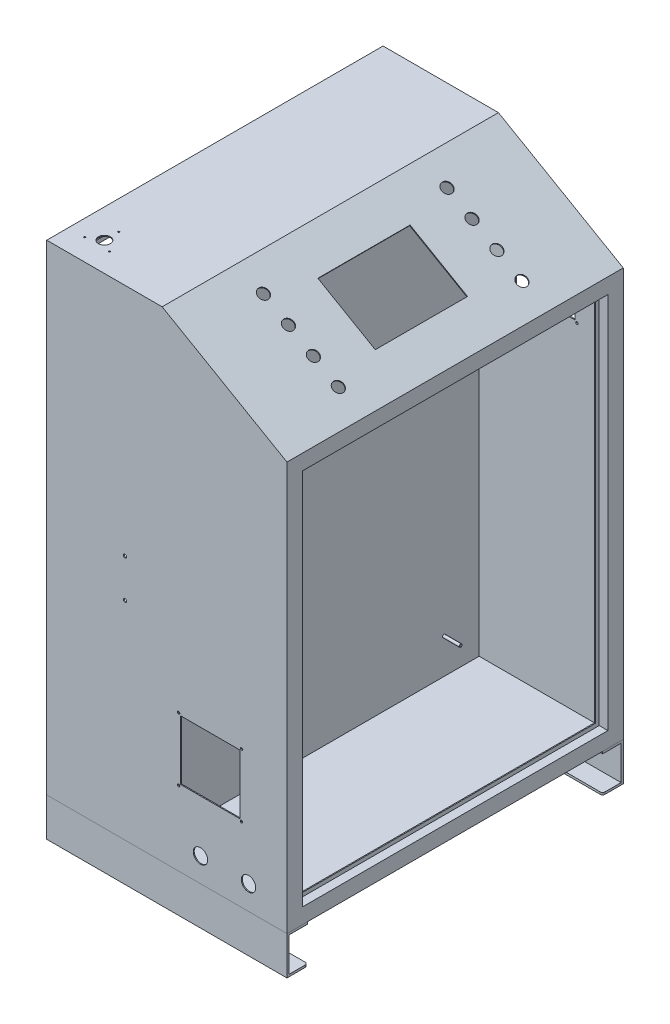
from build123d import *

# Parameters (mm, degrees)
EXTRUDE_1_DEPTH             = 348
EXTRUDE_2_DEPTH             = 2
EXTRUDE_3_DEPTH             = 2
SKETCH_4_W                  = 640
SKETCH_4_H                  = 790
CUT_EXTRUDE_1_DEPTH         = 10
SKETCH_7_W                  = 640
SKETCH_7_H                  = 790
SKETCH_7_W_2                = 636
SKETCH_7_H_2                = 786
EXTRUDE_4_DEPTH             = 18
SKETCH_8_W                  = 696
SKETCH_8_H                  = 996
CUT_EXTRUDE_2_DEPTH         = 10
SKETCH_9_W                  = 640
SKETCH_9_H                  = 790
SKETCH_9_W_2                = 620
SKETCH_9_H_2                = 770
EXTRUDE_5_DEPTH             = 2
EXTRUDE_START               = -200
SKETCH_10_W                 = 696
SKETCH_10_H                 = 996
EXTRUDE_6_DEPTH             = 2
SKETCH_11_W                 = 138
SKETCH_11_H                 = 192
CUT_EXTRUDE_3_DEPTH         = 10
EXTRUDE_7_DEPTH             = 500
EXTRUDE_7_2_DEPTH           = 500
SKETCH_13_R                 = 11.25
CUT_EXTRUDE_4_DEPTH         = 10
SKETCH_23_R                 = 15
CUT_EXTRUDE_8_DEPTH         = 10
SKETCH_29_R                 = 2.5
SKETCH_29_W                 = 124
SKETCH_29_H                 = 124
CUT_EXTRUDE_13_DEPTH        = 10
SKETCH_31_R                 = 12.5
CUT_EXTRUDE_16_DEPTH        = 10
SKETCH_34_W                 = 696
SKETCH_34_H                 = 996
SKETCH_34_W_2               = 640
SKETCH_34_H_2               = 940
EXTRUDE_10_DEPTH            = 2
SKETCH_36_W                 = 640
SKETCH_36_H                 = 940
SKETCH_36_W_2               = 636
SKETCH_36_H_2               = 936
EXTRUDE_11_DEPTH            = 18
SKETCH_37_W                 = 636
SKETCH_37_H                 = 936
SKETCH_37_W_2               = 620
SKETCH_37_H_2               = 920
EXTRUDE_12_DEPTH            = 2
FILLET_1_R                  = 5
FILLET_2_R                  = 5
SKETCH_41_R                 = 2.5
SKETCH_41_W                 = 124
SKETCH_41_H                 = 124
CUT_EXTRUDE_21_DEPTH        = 10
SKETCH_42_R                 = 3
EXTRUDE_13_DEPTH            = 35
CHAMFER_1_SIZE              = 0.5
HOLE_WIZARD_M4_1_AT_2_COUNT = 2
HOLE_WIZARD_M4_1_AT_2_PITCH = 51.961524227
HOLE_WIZARD_M4_1_AT_3_COUNT = 2
HOLE_WIZARD_M4_1_AT_3_PITCH = 51.961524227
HOLE_WIZARD_M8_1_AT_2_COUNT = 2
HOLE_WIZARD_M8_1_AT_2_PITCH = 80


with BuildPart() as part:
    # 草图1 → 凸台-拉伸1 (new, symmetric)
    with BuildSketch(Plane.XY):
        Polygon((0, 0), (0, 1000), (240.192378865, 1000), (500, 850), (500, 0), align=None)
        Polygon((2, 2), (2, 998), (239.65648048, 998), (498, 848.845299462), (498, 2), align=None, mode=Mode.SUBTRACT)
    extrude(amount=EXTRUDE_1_DEPTH, both=True)

    # 草图2 → 凸台-拉伸2 (add)
    with BuildSketch(Plane.XY.offset(348)):
        Polygon((0, 0), (500, 0), (500, 850), (240.192378865, 1000), (0, 1000), align=None)
    extrude(amount=EXTRUDE_2_DEPTH)

    # 草图3 → 凸台-拉伸3 (add)
    with BuildSketch(Plane(origin=(0, 0, -348), x_dir=(-1, 0, 0), z_dir=(0, 0, -1))):
        Polygon((-500, 0), (0, 0), (0, 1000), (-240.192378865, 1000), (-500, 850), align=None)
    extrude(amount=EXTRUDE_3_DEPTH)

    # 草图4 → 切除-拉伸1 (cut)
    with BuildSketch(Plane(origin=(500, 0, 0), x_dir=(0, 0, -1), z_dir=(1, 0, 0))):
        with Locations((0, 425)):
            Rectangle(SKETCH_4_W, SKETCH_4_H)
    extrude(amount=-CUT_EXTRUDE_1_DEPTH, mode=Mode.SUBTRACT)

    # 草图7 → 凸台-拉伸4 (add)
    with BuildSketch(Plane(origin=(500, 0, 0), x_dir=(0, 0, -1), z_dir=(1, 0, 0))):
        with Locations((0, 425)):
            Rectangle(SKETCH_7_W, SKETCH_7_H)
        with Locations((0, 425)):
            Rectangle(SKETCH_7_W_2, SKETCH_7_H_2, mode=Mode.SUBTRACT)
    extrude(amount=-EXTRUDE_4_DEPTH)

    # 草图8 → 切除-拉伸2 (cut)
    with BuildSketch(Plane.ZY):
        with Locations((0, 500)):
            Rectangle(SKETCH_8_W, SKETCH_8_H)
    extrude(amount=-CUT_EXTRUDE_2_DEPTH, mode=Mode.SUBTRACT)

    # 草图9 → 凸台-拉伸5 (add)
    with BuildSketch(Plane.ZY.offset(-482)):
        with Locations((0, 425)):
            Rectangle(SKETCH_9_W, SKETCH_9_H)
        with Locations((0, 425)):
            Rectangle(SKETCH_9_W_2, SKETCH_9_H_2, mode=Mode.SUBTRACT)
    extrude(amount=EXTRUDE_5_DEPTH)

    # 草图11 → 切除-拉伸3 (cut)
    with BuildSketch(Plane(origin=(493.060796608, 854.006350946, 0), x_dir=(0.866025403784438, -0.5000000000000011, 0), z_dir=(0.5000000000000011, 0.8660254037844382, 0))):
        with Locations((-141.987298108, 0)):
            Rectangle(SKETCH_11_W, SKETCH_11_H)
    extrude(amount=-CUT_EXTRUDE_3_DEPTH, mode=Mode.SUBTRACT)

    # 草图13 → 切除-拉伸4 (cut)
    with BuildSketch(Plane(origin=(493.060796608, 854.006350946, 0), x_dir=(0.866025403784438, -0.5000000000000011, 0), z_dir=(0.5000000000000011, 0.8660254037844382, 0))):
        with Locations(Location((-171.987298108, 191, 0), (0, 0, 180))):
            Circle(SKETCH_13_R)
        with Locations(Location((-231.987298108, 191, 0), (0, 0, 180))):
            Circle(SKETCH_13_R)
        with Locations((-51.987298108, 191)):
            Circle(SKETCH_13_R)
        with Locations((-111.987298108, 191)):
            Circle(SKETCH_13_R)
    cut_extrude_4 = extrude(amount=-CUT_EXTRUDE_4_DEPTH, mode=Mode.SUBTRACT)

    # 草图23 → 切除-拉伸8 (cut)
    with BuildSketch(Plane.XY.offset(350)):
        with Locations((420, 50)):
            Circle(SKETCH_23_R)
        with Locations((320, 50)):
            Circle(SKETCH_23_R)
    extrude(amount=-CUT_EXTRUDE_8_DEPTH, mode=Mode.SUBTRACT)

    # 草图29 → 切除-拉伸13 (cut)
    with BuildSketch(Plane(origin=(0, 0, -350), x_dir=(-1, 0, 0), z_dir=(0, 0, -1))):
        with Locations((-274.5, 835.5)):
            Circle(SKETCH_29_R)
        with Locations((-274.5, 704.5)):
            Circle(SKETCH_29_R)
        with Locations((-405.5, 835.5)):
            Circle(SKETCH_29_R)
        with Locations((-405.5, 704.5)):
            Circle(SKETCH_29_R)
        with Locations((-340, 770)):
            Rectangle(SKETCH_29_W, SKETCH_29_H)
    extrude(amount=-CUT_EXTRUDE_13_DEPTH, mode=Mode.SUBTRACT)

    # 草图31 → 切除-拉伸16 (cut)
    with BuildSketch(Plane(origin=(0, 1000, 0), x_dir=(1, 0, 0), z_dir=(0, 1, 0))):
        with Locations(Location((60, -290, 0), (0, 0, 270))):
            Circle(SKETCH_31_R)
    extrude(amount=-CUT_EXTRUDE_16_DEPTH, mode=Mode.SUBTRACT)

    # 草图34 → 凸台-拉伸10 (add)
    with BuildSketch(Plane.ZY):
        with Locations((0, 500)):
            Rectangle(SKETCH_34_W, SKETCH_34_H)
        with Locations((0, 500)):
            Rectangle(SKETCH_34_W_2, SKETCH_34_H_2, mode=Mode.SUBTRACT)
    extrude(amount=-EXTRUDE_10_DEPTH)

    # 镜向1: 切除-拉伸4 across plane
    add(cut_extrude_4.mirror(Plane.XY), mode=Mode.SUBTRACT)

    # 草图41 → 切除-拉伸21 (cut)
    with BuildSketch(Plane.XY.offset(350)):
        with Locations((274.5, 285.5)):
            Circle(SKETCH_41_R)
        with Locations((274.5, 154.5)):
            Circle(SKETCH_41_R)
        with Locations((405.5, 154.5)):
            Circle(SKETCH_41_R)
        with Locations((405.5, 285.5)):
            Circle(SKETCH_41_R)
        with Locations((340, 220)):
            Rectangle(SKETCH_41_W, SKETCH_41_H)
    extrude(amount=-CUT_EXTRUDE_21_DEPTH, mode=Mode.SUBTRACT)


with BuildPart() as body_2:
    # 草图10 → 凸台-拉伸6 (new body)
    with BuildSketch(Plane.ZY.offset(EXTRUDE_START)):
        with Locations((0, 500)):
            Rectangle(SKETCH_10_W, SKETCH_10_H)
    extrude(amount=-EXTRUDE_6_DEPTH)


    add(part.part)  # 凸台-拉伸13 merges part
    # 草图42 → 凸台-拉伸13 (add)
    with BuildSketch(Plane(origin=(202, 0, 0), x_dir=(0, 0, -1), z_dir=(1, 0, 0))):
        with Locations(Location((-275, 925, 0), (0, 0, 270))):
            Circle(SKETCH_42_R)
        with Locations(Location((275, 925, 0), (0, 0, 270))):
            Circle(SKETCH_42_R)
        with Locations(Location((-275, 75, 0), (0, 0, 270))):
            Circle(SKETCH_42_R)
        with Locations(Location((275, 75, 0), (0, 0, 270))):
            Circle(SKETCH_42_R)
    extrude(amount=EXTRUDE_13_DEPTH)

    # 倒角1
    chamfer_1_edges = [body_2.edges().sort_by_distance(p)[0] for p in [
        (237, 928, -275),
        (237, 78, 275),
        (237, 78, -275),
        (237, 928, 275),
    ]]
    chamfer(chamfer_1_edges, length=CHAMFER_1_SIZE)

    # 草图44 → M4 螺纹孔1 (revolve, cut)
    with BuildSketch(Plane(origin=(85.980762114, 1000, 305), x_dir=(0, 0, 1), z_dir=(1, 0, 0))):
        Polygon((0, 0), (0, 11.091420021), (1.65, 10.1), (1.65, 0), align=None)
    hole_wizard_m4_1 = revolve(axis=Axis((85.980762114, 1006.35, 305), (0, -1, 0)), mode=Mode.SUBTRACT)

    # M4 螺纹孔1 at 2: M4 螺纹孔1 ×2
    with Locations(*[Vector(-0.49999999999999684, 0, -0.8660254037844405) * (i * HOLE_WIZARD_M4_1_AT_2_PITCH) for i in range(1, HOLE_WIZARD_M4_1_AT_2_COUNT)]):
        add(hole_wizard_m4_1, mode=Mode.SUBTRACT)

    # M4 螺纹孔1 at 3: M4 螺纹孔1 ×2
    with Locations(*[(-i * HOLE_WIZARD_M4_1_AT_3_PITCH, 0, 0) for i in range(1, HOLE_WIZARD_M4_1_AT_3_COUNT)]):
        add(hole_wizard_m4_1, mode=Mode.SUBTRACT)

    # 草图46 → M8 螺纹孔1 (revolve, cut)
    with BuildSketch(Plane(origin=(163, 432, 350), x_dir=(0, -1, 0), z_dir=(1, 0, 0))):
        Polygon((0, 0), (0, 21.792926105), (3.4, 19.75), (3.4, 0), align=None)
    hole_wizard_m8_1 = revolve(axis=Axis((163, 432, 356.35), (0, 0, -1)), mode=Mode.SUBTRACT)

    # M8 螺纹孔1 at 2: M8 螺纹孔1 ×2
    with Locations(*[(0, i * HOLE_WIZARD_M8_1_AT_2_PITCH, 0) for i in range(1, HOLE_WIZARD_M8_1_AT_2_COUNT)]):
        add(hole_wizard_m8_1, mode=Mode.SUBTRACT)


with BuildPart() as body_3:
    # 草图12 → 凸台-拉伸7 (new body)
    with BuildSketch(Plane(origin=(500, 0, 0), x_dir=(0, 0, -1), z_dir=(1, 0, 0))):
        Polygon((-350, 0), (-350, -80), (-307, -80), (-307, -75.5), (-345.5, -75.5), (-345.5, -4.5), (-307, -4.5), (-307, 0), align=None)
    extrude(amount=-EXTRUDE_7_DEPTH)

    # 圆角1
    fillet_1_edges = [body_3.edges().sort_by_distance(p)[0] for p in [
        (0, -77.75, 307),
        (500, -77.75, 307),
    ]]
    fillet(fillet_1_edges, radius=FILLET_1_R)


with BuildPart() as body_4:
    # 草图12 → Extrude 7 2 (new body)
    with BuildSketch(Plane(origin=(500, 0, 0), x_dir=(0, 0, -1), z_dir=(1, 0, 0))):
        Polygon((307, -75.5), (307, -80), (350, -80), (350, 0), (307, 0), (307, -4.5), (345.5, -4.5), (345.5, -75.5), align=None)
    extrude(amount=-EXTRUDE_7_2_DEPTH)

    # 圆角2
    fillet_2_edges = [body_4.edges().sort_by_distance(p)[0] for p in [
        (0, -77.75, -307),
        (500, -77.75, -307),
    ]]
    fillet(fillet_2_edges, radius=FILLET_2_R)


with BuildPart() as body_5:
    # 草图36 → 凸台-拉伸11 (new body)
    with BuildSketch(Plane.ZY):
        with Locations((0, 500)):
            Rectangle(SKETCH_36_W, SKETCH_36_H)
        with Locations((0, 500)):
            Rectangle(SKETCH_36_W_2, SKETCH_36_H_2, mode=Mode.SUBTRACT)
    extrude(amount=-EXTRUDE_11_DEPTH)


with BuildPart() as body_6:
    # 草图37 → 凸台-拉伸12 (new body)
    with BuildSketch(Plane(origin=(18, 0, 0), x_dir=(0, 0, -1), z_dir=(1, 0, 0))):
        with Locations((0, 500)):
            Rectangle(SKETCH_37_W, SKETCH_37_H)
        with Locations((0, 500)):
            Rectangle(SKETCH_37_W_2, SKETCH_37_H_2, mode=Mode.SUBTRACT)
    extrude(amount=EXTRUDE_12_DEPTH)


solid = Compound([body_2.part, body_3.part, body_4.part, body_5.part, body_6.part])
